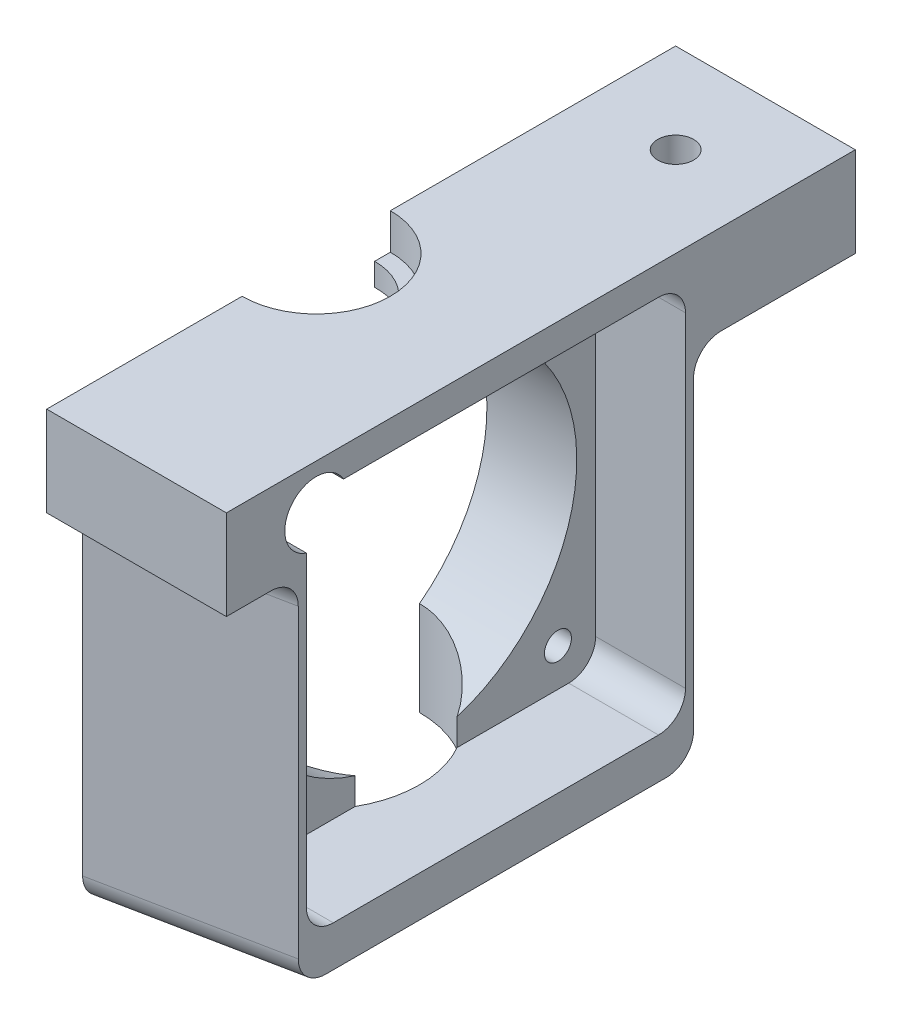
from build123d import *

# Parameters (mm, degrees)
SKETCH1_W           = 20
SKETCH1_H           = 70
BOSS_EXTRUDE1_DEPTH = 20
SKETCH4_W           = 20
SKETCH4_H           = 70
CUT_EXTRUDE3_DEPTH  = 10
SKETCH5_R           = 6.5
CUT_EXTRUDE4_DEPTH  = 10
SKETCH6_R           = 8.25
CUT_EXTRUDE5_DEPTH  = 4
SKETCH7_R           = 2
CUT_EXTRUDE6_DEPTH  = 20
SKETCH8_R           = 2
CUT_EXTRUDE7_DEPTH  = 20
SKETCH9_W           = 10
SKETCH9_H           = 52
BOSS_EXTRUDE2_DEPTH = 52
SKETCH10_W          = 10
SKETCH10_H          = 52
CUT_EXTRUDE8_DEPTH  = 12
SKETCH11_W          = 42.2
SKETCH11_H          = 42.2
CUT_EXTRUDE9_DEPTH  = 5
SKETCH12_W          = 42.2
SKETCH12_H          = 42.2
CUT_EXTRUDE10_DEPTH = 5
SKETCH13_W          = 52
SKETCH13_H          = 40
BOSS_EXTRUDE3_DEPTH = 10
SKETCH14_R          = 11.5
CUT_EXTRUDE11_DEPTH = 100
SKETCH16_R          = 19
CUT_EXTRUDE12_DEPTH = 100
SKETCH17_R          = 1.5
CUT_EXTRUDE13_DEPTH = 100
CUT_EXTRUDE14_DEPTH = 40
FILLET1_R           = 3
FILLET2_R           = 3
FILLET3_R           = 3
FILLET4_R           = 3
FILLET5_R           = 3
FILLET6_R           = 3
FILLET7_R           = 3
CUT_EXTRUDE15_DEPTH = 2.5
SKETCH21_R          = 3.5
CUT_EXTRUDE16_DEPTH = 13


with BuildPart() as part:
    # Sketch1 → Boss-Extrude1 (new body)
    with BuildSketch(Plane(origin=(0, 0, 0), x_dir=(1, 0, 0), z_dir=(0, 1, 0))):
        with Locations((10, 35)):
            Rectangle(SKETCH1_W, SKETCH1_H)
    extrude(amount=BOSS_EXTRUDE1_DEPTH)

    # Sketch4 → Cut-Extrude3 (cut)
    with BuildSketch(Plane(origin=(0, 20, 0), x_dir=(1, 0, 0), z_dir=(0, 1, 0))):
        with Locations((10, 35)):
            Rectangle(SKETCH4_W, SKETCH4_H)
    extrude(amount=-CUT_EXTRUDE3_DEPTH, mode=Mode.SUBTRACT)

    # Sketch5 → Cut-Extrude4 (cut)
    with BuildSketch(Plane(origin=(0, 10, 0), x_dir=(1, 0, 0), z_dir=(0, 1, 0))):
        with Locations((0, 30)):
            Circle(SKETCH5_R)
    extrude(amount=-CUT_EXTRUDE4_DEPTH, mode=Mode.SUBTRACT)

    # Sketch6 → Cut-Extrude5 (cut)
    with BuildSketch(Plane(origin=(0, 10, 0), x_dir=(1, 0, 0), z_dir=(0, 1, 0))):
        with Locations((0, 30)):
            Circle(SKETCH6_R)
    extrude(amount=-CUT_EXTRUDE5_DEPTH, mode=Mode.SUBTRACT)

    # Sketch7 → Cut-Extrude6 (cut)
    with BuildSketch(Plane(origin=(20, 0, 0), x_dir=(0, 0, -1), z_dir=(1, 0, 0))):
        with Locations((10, 5)):
            Circle(SKETCH7_R)
    extrude(amount=-CUT_EXTRUDE6_DEPTH, mode=Mode.SUBTRACT)

    # Sketch8 → Cut-Extrude7 (cut)
    with BuildSketch(Plane(origin=(0, 10, 0), x_dir=(1, 0, 0), z_dir=(0, 1, 0))):
        with Locations(Location((10, 60, 0), (0, 0, 270))):
            Circle(SKETCH8_R)
    extrude(amount=-CUT_EXTRUDE7_DEPTH, mode=Mode.SUBTRACT)

    # Sketch9 → Boss-Extrude2 (add)
    with BuildSketch(Plane.XZ):
        with Locations((15, -30)):
            Rectangle(SKETCH9_W, SKETCH9_H)
    extrude(amount=BOSS_EXTRUDE2_DEPTH)

    # Sketch10 → Cut-Extrude8 (cut)
    with BuildSketch(Plane.XZ.offset(52)):
        with Locations((15, -30)):
            Rectangle(SKETCH10_W, SKETCH10_H)
    extrude(amount=-CUT_EXTRUDE8_DEPTH, mode=Mode.SUBTRACT)

    # Sketch11 → Cut-Extrude9 (cut)
    with BuildSketch(Plane(origin=(20, 0, 0), x_dir=(0, 0, -1), z_dir=(1, 0, 0))):
        with Locations((30, -14.365359388)):
            Rectangle(SKETCH11_W, SKETCH11_H)
    extrude(amount=-CUT_EXTRUDE9_DEPTH, mode=Mode.SUBTRACT)

    # Sketch12 → Cut-Extrude10 (cut)
    with BuildSketch(Plane(origin=(15, 0, 0), x_dir=(0, 0, -1), z_dir=(1, 0, 0))):
        with Locations((30, -14.365359388)):
            Rectangle(SKETCH12_W, SKETCH12_H)
    extrude(amount=-CUT_EXTRUDE10_DEPTH, mode=Mode.SUBTRACT)

    # Sketch13 → Boss-Extrude3 (add)
    with BuildSketch(Plane.ZY.offset(-10)):
        with Locations((-30, -20)):
            Rectangle(SKETCH13_W, SKETCH13_H)
    extrude(amount=BOSS_EXTRUDE3_DEPTH)

    # Sketch14 → Cut-Extrude11 (cut)
    with BuildSketch(Plane(origin=(0, 0, 0), x_dir=(1, 0, 0), z_dir=(0, 1, 0))):
        with Locations((0, 30)):
            Circle(SKETCH14_R)
    extrude(amount=-CUT_EXTRUDE11_DEPTH, mode=Mode.SUBTRACT)

    # Sketch16 → Cut-Extrude12 (cut)
    with BuildSketch(Plane(origin=(10, 0, 0), x_dir=(0, 0, -1), z_dir=(1, 0, 0))):
        with Locations((30, -14.365359388)):
            Circle(SKETCH16_R)
    extrude(amount=-CUT_EXTRUDE12_DEPTH, mode=Mode.SUBTRACT)

    # Sketch17 → Cut-Extrude13 (cut)
    with BuildSketch(Plane(origin=(10, 0, 0), x_dir=(0, 0, -1), z_dir=(1, 0, 0))):
        with Locations((13.1, 2.534640612)):
            Circle(SKETCH17_R)
        with Locations((46.9, 2.534640612)):
            Circle(SKETCH17_R)
        with Locations((13.1, -31.265359388)):
            Circle(SKETCH17_R)
        with Locations((46.9, -31.265359388)):
            Circle(SKETCH17_R)
    extrude(amount=-CUT_EXTRUDE13_DEPTH, mode=Mode.SUBTRACT)

    # Sketch19 → Cut-Extrude14 (cut)
    with BuildSketch(Plane.XZ.offset(40)):
        Polygon((20, -56), (20, -52), (0, -56), align=None)
        Polygon((20, -4), (20, -8), (0, -4), align=None)
    extrude(amount=-CUT_EXTRUDE14_DEPTH, mode=Mode.SUBTRACT)

    # Fillet1
    fillet1_edges = [part.edges().sort_by_distance(p)[0] for p in [
        (10, -40, -6),
    ]]
    fillet(fillet1_edges, radius=FILLET1_R)

    # Fillet2
    fillet2_edges = [part.edges().sort_by_distance(p)[0] for p in [
        (10, -40, -54),
    ]]
    fillet(fillet2_edges, radius=FILLET2_R)

    # Fillet3
    fillet3_edges = [part.edges().sort_by_distance(p)[0] for p in [
        (10, 0, -54),
    ]]
    fillet(fillet3_edges, radius=FILLET3_R)

    # Fillet4
    fillet4_edges = [part.edges().sort_by_distance(p)[0] for p in [
        (10, 0, -6),
    ]]
    fillet(fillet4_edges, radius=FILLET4_R)

    # Fillet5
    fillet5_edges = [part.edges().sort_by_distance(p)[0] for p in [
        (15, 6.734640612, -51.1),
    ]]
    fillet(fillet5_edges, radius=FILLET5_R)

    # Fillet6
    fillet6_edges = [part.edges().sort_by_distance(p)[0] for p in [
        (15, -35.465359388, -8.9),
    ]]
    fillet(fillet6_edges, radius=FILLET6_R)

    # Fillet7
    fillet7_edges = [part.edges().sort_by_distance(p)[0] for p in [
        (15, -35.465359388, -51.1),
    ]]
    fillet(fillet7_edges, radius=FILLET7_R)

    # Sketch20 → Cut-Extrude15 (cut)
    with BuildSketch(Plane.ZY):
        Polygon((-16.1, -31.265359388), (-14.6, -33.8634356), (-11.6, -33.8634356), (-10.1, -31.265359388), (-11.6, -28.667283177), (-14.6, -28.667283177), align=None)
        Polygon((-49.9, -31.265359388), (-48.4, -33.8634356), (-45.4, -33.8634356), (-43.9, -31.265359388), (-45.4, -28.667283177), (-48.4, -28.667283177), align=None)
        Polygon((-49.9, 2.534640612), (-48.4, -0.0634356), (-45.4, -0.0634356), (-43.9, 2.534640612), (-45.4, 5.132716823), (-48.4, 5.132716823), align=None)
    extrude(amount=-CUT_EXTRUDE15_DEPTH, mode=Mode.SUBTRACT)

    # Sketch21 → Cut-Extrude16 (cut)
    with BuildSketch(Plane(origin=(20, 0, 0), x_dir=(0, 0, -1), z_dir=(1, 0, 0))):
        with Locations((10, 5)):
            Circle(SKETCH21_R)
    extrude(amount=-CUT_EXTRUDE16_DEPTH, mode=Mode.SUBTRACT)


solid = part.part
